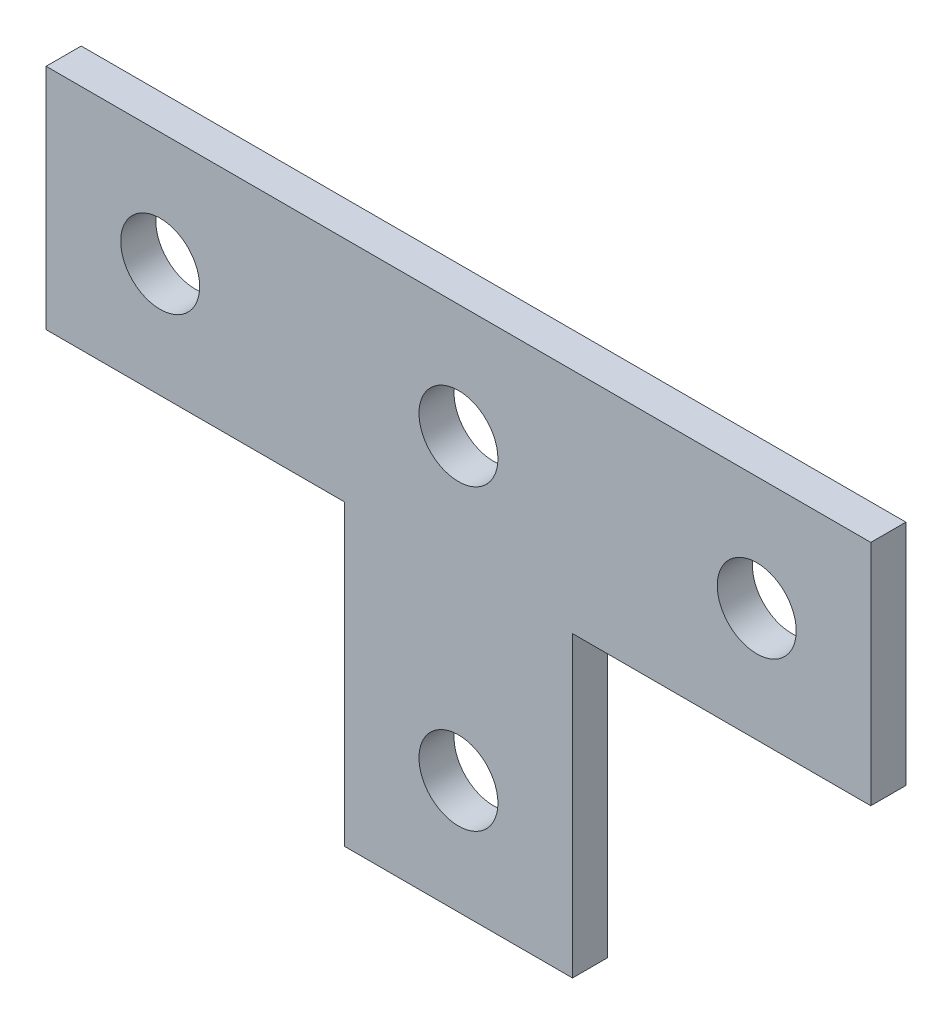
from build123d import *

# Parameters (mm, degrees)
BOSS_EXTRUDE1_DEPTH      = 1.5875
BOSS_EXTRUDE1_DEPTH_BACK = 1.5875
SKETCH3_R                = 3.571875


with BuildPart() as part:
    # Sketch3 → Boss-Extrude1 (new, two sides: drawn at the far end of the back side and taken through both)
    with BuildSketch(Plane.XY.offset(-BOSS_EXTRUDE1_DEPTH_BACK)):
        Polygon((-10.31875, -23.8125), (10.31875, -23.8125), (10.31875, 3.175), (37.30625, 3.175), (37.30625, 23.8125), (-37.30625, 23.8125), (-37.30625, 3.175), (-10.31875, 3.175), align=None)
        with Locations((26.9875, 13.49375)):
            Circle(SKETCH3_R, mode=Mode.SUBTRACT)
        with Locations((0, -13.49375)):
            Circle(SKETCH3_R, mode=Mode.SUBTRACT)
        with Locations((-26.9875, 13.49375)):
            Circle(SKETCH3_R, mode=Mode.SUBTRACT)
        with Locations((0, 13.49375)):
            Circle(SKETCH3_R, mode=Mode.SUBTRACT)
    extrude(amount=BOSS_EXTRUDE1_DEPTH + BOSS_EXTRUDE1_DEPTH_BACK)


solid = part.part
